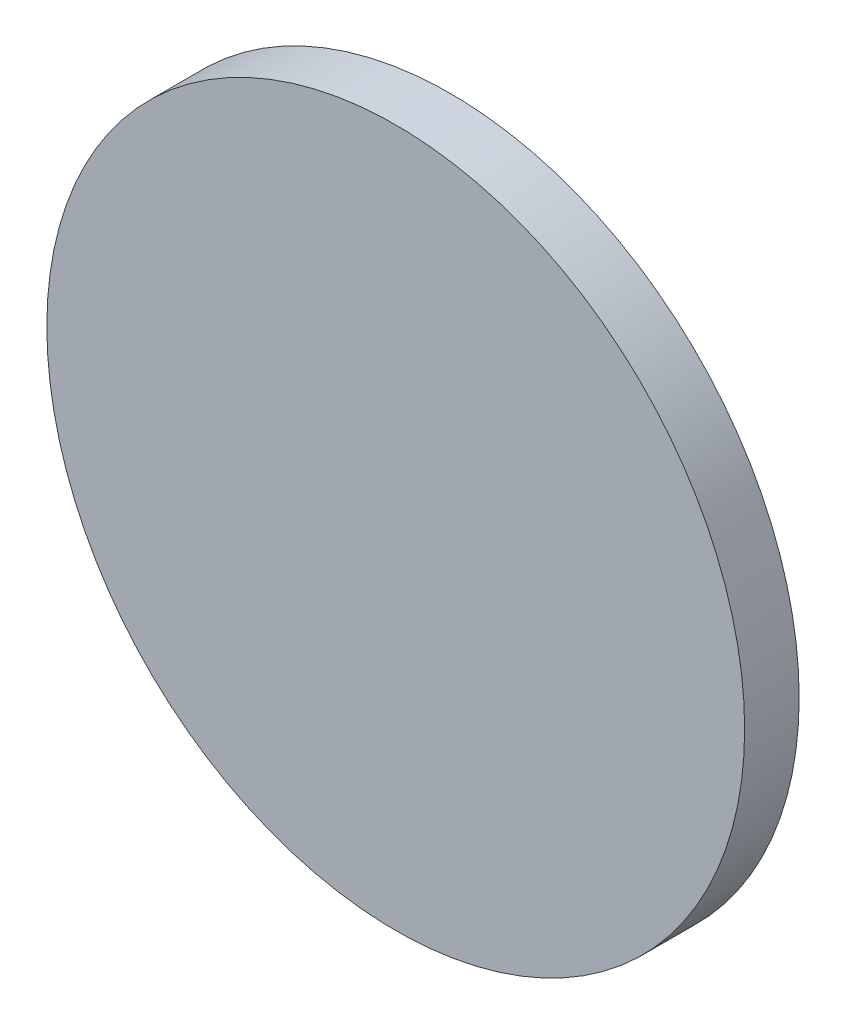
from build123d import *

# Parameters (mm, degrees)
SKETCH1_R           = 64
BOSS_EXTRUDE2_DEPTH = 10


with BuildPart() as part:
    # Sketch1 → Boss-Extrude2 (new body)
    with BuildSketch(Plane.XY):
        Circle(SKETCH1_R)
    extrude(amount=BOSS_EXTRUDE2_DEPTH)


solid = part.part
